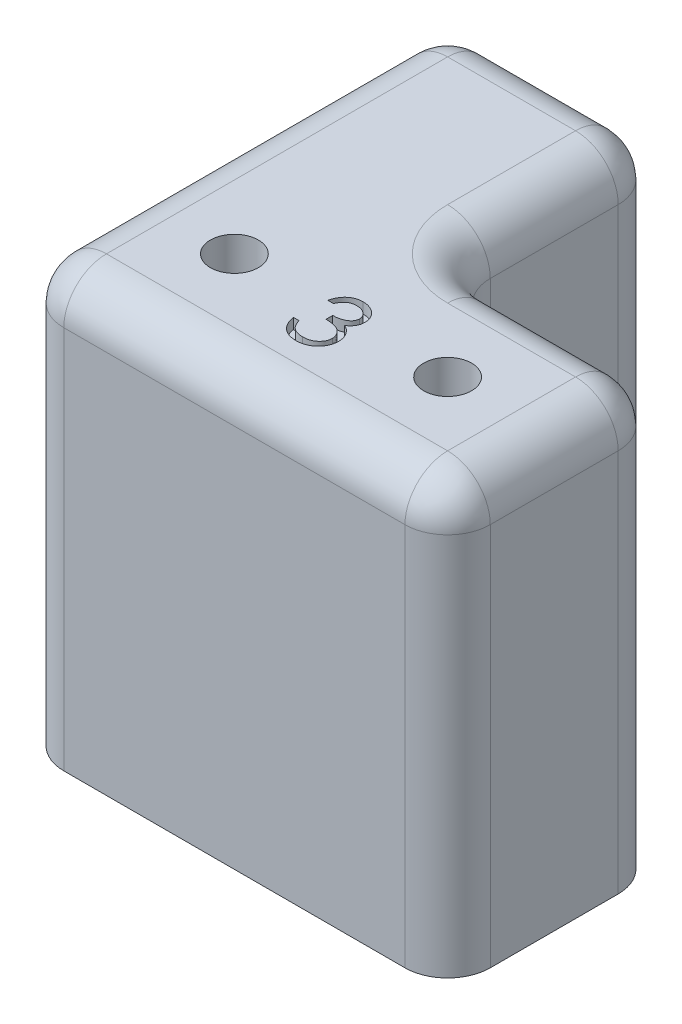
from build123d import *

# Parameters (mm, degrees)
SALIENTE_EXTRUIR1_DEPTH = 40
CORTAR_EXTRUIR1_REACH   = 71.282
CROQUIS2_R              = 2.25
REDONDEO3_R             = 4
CROQUIS3_R              = 4.15
CORTAR_EXTRUIR3_DEPTH   = 25
CORTAR_EXTRUIR5_DEPTH   = 1
CROQUIS7_R              = 2.65
CORTAR_EXTRUIR6_DEPTH   = 70.28203236


with BuildPart() as part:
    # Croquis1 → Saliente-Extruir1 (new body)
    with BuildSketch(Plane(origin=(0, 0, 0), x_dir=(1, 0, 0), z_dir=(0, 1, 0))):
        Polygon((0, 0), (40, 0), (40, 20), (20, 20), (20, 40), (0, 40), align=None)
    extrude(amount=SALIENTE_EXTRUIR1_DEPTH)

    # Croquis2 → Cortar-Extruir1 (cut, up to next)
    with BuildSketch(Plane(origin=(0, 40, 0), x_dir=(1, 0, 0), z_dir=(0, 1, 0)), mode=Mode.PRIVATE) as cortar_extruir1_sk1:
        with Locations(Location((30, 10, 0), (0, 0, 270))):
            Circle(CROQUIS2_R)
    cortar_extruir1_tool1 = extrude(cortar_extruir1_sk1.sketch, amount=-CORTAR_EXTRUIR1_REACH, mode=Mode.PRIVATE) & part.part
    # Croquis2 → Cortar-Extruir1 (cut, up to next)
    with BuildSketch(Plane(origin=(0, 40, 0), x_dir=(1, 0, 0), z_dir=(0, 1, 0)), mode=Mode.PRIVATE) as cortar_extruir1_sk2:
        with Locations(Location((10, 10, 0), (0, 0, 270))):
            Circle(CROQUIS2_R)
    cortar_extruir1_tool2 = extrude(cortar_extruir1_sk2.sketch, amount=-CORTAR_EXTRUIR1_REACH, mode=Mode.PRIVATE) & part.part
    add(cortar_extruir1_tool1.solids().sort_by_distance((30, 40, -10))[0], mode=Mode.SUBTRACT)
    add(cortar_extruir1_tool2.solids().sort_by_distance((10, 40, -10))[0], mode=Mode.SUBTRACT)

    # Redondeo3
    redondeo3_edges = [part.edges().sort_by_distance(p)[0] for p in [
        (40, 40, -10),
        (0, 20, -40),
        (20, 20, -40),
        (20, 20, -20),
        (40, 20, -20),
        (40, 20, 0),
        (0, 20, 0),
        (30, 40, -20),
        (20, 40, -30),
        (10, 40, -40),
        (0, 40, -20),
        (20, 40, 0),
    ]]
    fillet(redondeo3_edges, radius=REDONDEO3_R)

    # Croquis3 → Cortar-Extruir3 (cut)
    with BuildSketch(Plane(origin=(0, 0, -40), x_dir=(-1, 0, 0), z_dir=(0, 0, -1))):
        with Locations((-10, 30)):
            Circle(CROQUIS3_R)
    extrude(amount=-CORTAR_EXTRUIR3_DEPTH, mode=Mode.SUBTRACT)

    # Croquis6 → Cortar-Extruir5 (cut)
    with BuildSketch(Plane(origin=(0, 40, 0), x_dir=(1, 0, 0), z_dir=(0, 1, 0))):
        with BuildLine():
            Line((18.692307692, 10.607697294), (18.153846154, 10.607697294))
            add(Edge.make_bspline(
                [(18.153846154, 10.607697294), (18.168433955, 10.668095838), (18.196951913, 10.786170051), (18.256433468, 10.954868213), (18.321232191, 11.114508535), (18.399042084, 11.262101804), (18.483914234, 11.400614209), (18.581153186, 11.526904137), (18.68627271, 11.644183506), (18.802544052, 11.748263342), (18.9244789, 11.842510878), (19.053795391, 11.922868119), (19.18789178, 11.991995238), (19.327697151, 12.048944207), (19.473627731, 12.091845105), (19.624364228, 12.122971057), (19.780301657, 12.143184396), (19.88615467, 12.145157132), (19.939903846, 12.146158832)],
                knots=[0, 0, 0, 0, 1.162005537, 2.271625781, 3.343758855, 4.383309926, 5.390229558, 6.379919256, 7.361854164, 8.333198761, 9.295911338, 10.242430842, 11.177959212, 12.116337295, 13.062827104, 14.020064771, 14.994644689, 16, 16, 16, 16], degree=3))
            add(Edge.make_bspline(
                [(19.939903846, 12.146158832), (20.018217118, 12.143794438), (20.173135423, 12.139117223), (20.400729218, 12.09640676), (20.620203765, 12.028820819), (20.829156761, 11.935437287), (21.023245502, 11.820259036), (21.195936108, 11.683176629), (21.344887841, 11.52683497), (21.469849631, 11.354150574), (21.567692487, 11.169598272), (21.639840556, 10.979655145), (21.683763437, 10.784771766), (21.689455821, 10.653187859), (21.692307692, 10.587264602)],
                knots=[0, 0, 0, 0, 1.083050992, 2.142477498, 3.193116406, 4.255571735, 5.30263384, 6.308962982, 7.297363603, 8.282367274, 9.249857812, 10.179914175, 11.08814088, 12, 12, 12, 12], degree=3))
            add(Edge.make_bspline(
                [(21.692307692, 10.587264602), (21.690312965, 10.523824382), (21.686409593, 10.399681717), (21.653266097, 10.218444865), (21.597489647, 10.047630693), (21.520227197, 9.88652013), (21.42021311, 9.73613469), (21.299059916, 9.59613602), (21.155912496, 9.465903177), (21.047434316, 9.391298367), (20.991586538, 9.352889602)],
                knots=[0, 0, 0, 0, 1.024540389, 2.004866551, 2.965041327, 3.920577974, 4.882998113, 5.874504559, 6.905732034, 8, 8, 8, 8], degree=3))
            add(Edge.make_bspline(
                [(20.991586538, 9.352889602), (21.055412403, 9.322069879), (21.181869902, 9.261007095), (21.354242239, 9.141254367), (21.510718596, 9.002986343), (21.597982115, 8.895084653), (21.641826923, 8.840870371)],
                knots=[0, 0, 0, 0, 1.015518401, 2.012035669, 3.001164323, 4, 4, 4, 4], degree=3))
            add(Edge.make_bspline(
                [(21.641826923, 8.840870371), (21.670697796, 8.801342797), (21.72796676, 8.72293494), (21.798656247, 8.596872495), (21.862786157, 8.469412799), (21.912757962, 8.337139532), (21.951456019, 8.201585794), (21.979117789, 8.06251883), (21.99630203, 7.919825077), (21.998762976, 7.823289396), (22, 7.774764602)],
                knots=[0, 0, 0, 0, 1.025084078, 2.033381695, 3.024893161, 4.013698104, 4.991890475, 5.976764909, 6.982997093, 8, 8, 8, 8], degree=3))
            add(Edge.make_bspline(
                [(22, 7.774764602), (21.996923691, 7.690747937), (21.99078555, 7.523109991), (21.935921423, 7.275439039), (21.850870153, 7.033338178), (21.730086835, 6.801781311), (21.582885391, 6.585129229), (21.407758549, 6.391284128), (21.206696135, 6.224657949), (20.98245788, 6.085440416), (20.739514231, 5.974152549), (20.479670359, 5.896911218), (20.206670266, 5.84660379), (20.019457756, 5.841209158), (19.924278846, 5.838466525)],
                knots=[0, 0, 0, 0, 0.955779014, 1.907060117, 2.875433937, 3.871313158, 4.872415639, 5.851225146, 6.836215519, 7.83643374, 8.849228613, 9.86973379, 10.916971861, 12, 12, 12, 12], degree=3))
            add(Edge.make_bspline(
                [(19.924278846, 5.838466525), (19.860131474, 5.83995489), (19.733910837, 5.842883498), (19.548350554, 5.862903957), (19.371227641, 5.89946968), (19.202302616, 5.948675346), (19.041425411, 6.01106119), (18.889086945, 6.088750387), (18.744349984, 6.180141533), (18.608580354, 6.286313398), (18.481794238, 6.405081409), (18.367360996, 6.538553997), (18.26337278, 6.684263833), (18.172613971, 6.843903357), (18.090950623, 7.015409513), (18.023783269, 7.200978367), (17.964665151, 7.398950976), (17.937179213, 7.536912817), (17.923076923, 7.607697294)],
                knots=[0, 0, 0, 0, 1.048658725, 2.063410685, 3.046034179, 4.001477787, 4.936774919, 5.862367409, 6.792675028, 7.730719943, 8.675894397, 9.627829632, 10.600096036, 11.597688215, 12.626045268, 13.701542398, 14.82072376, 16, 16, 16, 16], degree=3))
            Line((17.923076923, 7.607697294), (18.461538462, 7.607697294))
            add(Edge.make_bspline(
                [(18.461538462, 7.607697294), (18.475566961, 7.561498986), (18.502853611, 7.471639263), (18.549300979, 7.342313024), (18.602218017, 7.223756362), (18.658985832, 7.115099581), (18.718606025, 7.015272606), (18.785317326, 6.926915116), (18.854178717, 6.846146198), (18.90608618, 6.800641149), (18.931490385, 6.778370371)],
                knots=[0, 0, 0, 0, 1.198163088, 2.33053128, 3.407730985, 4.417276592, 5.372219308, 6.28897303, 7.162600585, 8, 8, 8, 8], degree=3))
            add(Edge.make_bspline(
                [(18.931490385, 6.778370371), (18.965084516, 6.75247037), (19.032169081, 6.700750315), (19.141486048, 6.634747524), (19.256454424, 6.577557195), (19.379565295, 6.533870859), (19.508162044, 6.496880583), (19.644323241, 6.472673979), (19.786847614, 6.456065685), (19.88416378, 6.454600089), (19.933894231, 6.45385114)],
                knots=[0, 0, 0, 0, 0.946170439, 1.889420265, 2.845303464, 3.807233317, 4.801018734, 5.828864929, 6.890507805, 8, 8, 8, 8], degree=3))
            add(Edge.make_bspline(
                [(19.933894231, 6.45385114), (19.990043092, 6.454906978), (20.099837344, 6.456971577), (20.260045675, 6.475958503), (20.412458442, 6.50361064), (20.555383457, 6.546318611), (20.690692899, 6.599085785), (20.816490012, 6.665340194), (20.934426194, 6.743074003), (21.042990889, 6.831426846), (21.140611759, 6.928149409), (21.226565211, 7.029314674), (21.299636059, 7.134496096), (21.358579336, 7.244275732), (21.405123136, 7.358198981), (21.436808623, 7.476585546), (21.458839792, 7.598466574), (21.460633984, 7.681316235), (21.461538462, 7.723081909)],
                knots=[0, 0, 0, 0, 1.217147791, 2.380027433, 3.494444702, 4.572153297, 5.609568379, 6.639424714, 7.649109417, 8.668170816, 9.669597737, 10.625200337, 11.543417969, 12.441394052, 13.322311151, 14.205496177, 15.095365482, 16, 16, 16, 16], degree=3))
            add(Edge.make_bspline(
                [(21.461538462, 7.723081909), (21.458915087, 7.778987062), (21.453681393, 7.89051919), (21.413723828, 8.05460646), (21.348000061, 8.212703739), (21.255990042, 8.362113665), (21.143985935, 8.500586639), (21.013074666, 8.624137752), (20.862169132, 8.726086479), (20.723277928, 8.796524176), (20.600251945, 8.844587733), (20.494968429, 8.876601958), (20.377099966, 8.903711082), (20.24807194, 8.928932119), (20.10691214, 8.950397287), (19.953774246, 8.968297543), (19.788627227, 8.98262047), (19.674299514, 8.989016633), (19.615384615, 8.992312679)],
                knots=[0, 0, 0, 0, 1.07054697, 2.135767047, 3.216561865, 4.33974944, 5.486079747, 6.621378074, 7.775625952, 8.963672916, 9.598146892, 10.304877434, 11.070270905, 11.915000392, 12.823868403, 13.805723172, 14.86925407, 16, 16, 16, 16], degree=3))
            Line((19.615384615, 8.992312679), (19.615384615, 9.607697294))
            add(Edge.make_bspline(
                [(19.615384615, 9.607697294), (19.689615185, 9.608956958), (19.835014636, 9.611424329), (20.047404873, 9.641266632), (20.25050198, 9.682547709), (20.439804966, 9.745779467), (20.612345617, 9.819219976), (20.762036364, 9.904680907), (20.886780045, 9.99967762), (20.985970453, 10.105676379), (21.060591988, 10.219359317), (21.115152212, 10.337845016), (21.147381343, 10.462171978), (21.151683629, 10.54701998), (21.153846154, 10.589668448)],
                knots=[0, 0, 0, 0, 1.321986639, 2.589447074, 3.816329219, 5.01088745, 6.139805852, 7.153945165, 8.075214402, 8.924034688, 9.728124013, 10.488707548, 11.240355623, 12, 12, 12, 12], degree=3))
            add(Edge.make_bspline(
                [(21.153846154, 10.589668448), (21.153135735, 10.621001725), (21.151722391, 10.683337795), (21.133898486, 10.774409341), (21.107114416, 10.862696677), (21.070292022, 10.947824351), (21.021005968, 11.029201964), (20.962024276, 11.107523305), (20.891793247, 11.182341212), (20.811315338, 11.252078902), (20.724895101, 11.318540452), (20.630181201, 11.37496383), (20.530029416, 11.423212507), (20.424328865, 11.463000225), (20.312736527, 11.492930434), (20.195776714, 11.514420447), (20.073226399, 11.527856427), (19.989617716, 11.529790854), (19.947115385, 11.530774217)],
                knots=[0, 0, 0, 0, 0.884392785, 1.759457502, 2.611959086, 3.489218968, 4.37281399, 5.2945488, 6.255912374, 7.266815255, 8.301784654, 9.332968512, 10.37626691, 11.440494194, 12.520033166, 13.637162961, 14.798855837, 16, 16, 16, 16], degree=3))
            add(Edge.make_bspline(
                [(19.947115385, 11.530774217), (19.878798239, 11.528389025), (19.745358966, 11.52373019), (19.552990537, 11.482925024), (19.374157393, 11.417819738), (19.237462536, 11.340105991), (19.13652098, 11.263390961), (19.064389086, 11.196392585), (18.993553925, 11.121936316), (18.928675622, 11.035436244), (18.863063091, 10.942750318), (18.803329557, 10.839166864), (18.74528437, 10.727387902), (18.71030857, 10.648366814), (18.692307692, 10.607697294)],
                knots=[0, 0, 0, 0, 1.472543308, 2.876219568, 4.221790263, 5.565193594, 6.249813518, 6.953379497, 7.687249741, 8.463570142, 9.283606569, 10.136032583, 11.040678096, 12, 12, 12, 12], degree=3))
        make_face()
    extrude(amount=-CORTAR_EXTRUIR5_DEPTH, mode=Mode.SUBTRACT)

    # Croquis7 → Cortar-Extruir6 (cut, through all)
    with BuildSketch(Plane.ZY):
        with Locations((-26, 20)):
            Circle(CROQUIS7_R)
    extrude(amount=-CORTAR_EXTRUIR6_DEPTH, mode=Mode.SUBTRACT)


solid = part.part
